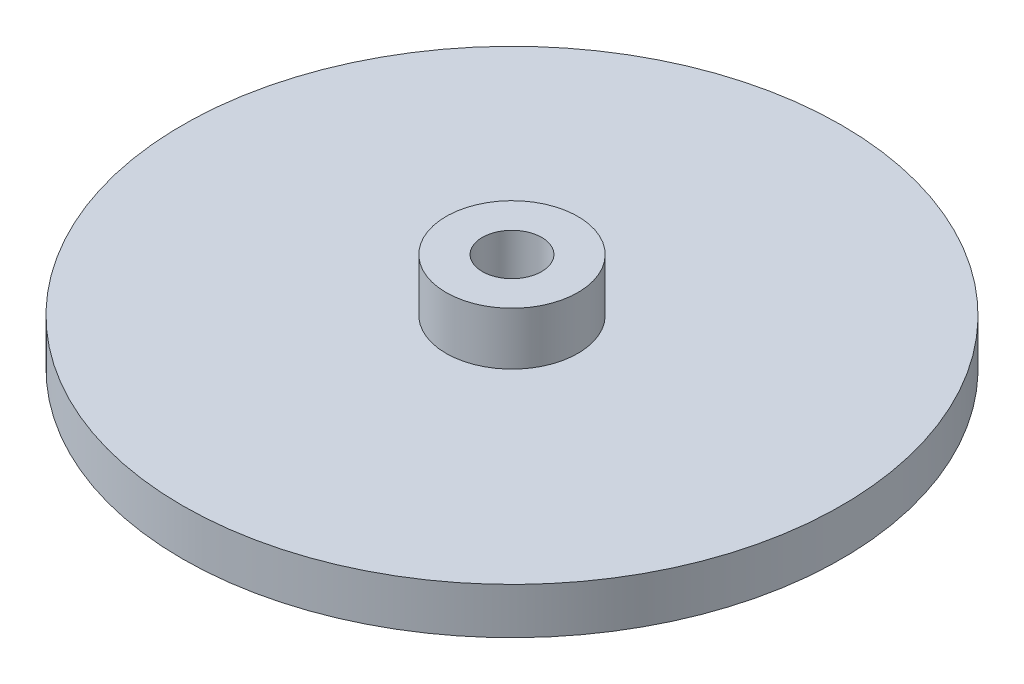
from build123d import *

# Parameters (mm, degrees)
SKETCH1_R           = 25
BOSS_EXTRUDE1_DEPTH = 2
SKETCH2_R           = 5
BOSS_EXTRUDE2_DEPTH = 4
SKETCH3_R           = 2.1
CUT_EXTRUDE1_DEPTH  = 20
SKETCH4_R           = 4.5
CUT_EXTRUDE2_DEPTH  = 5
SKETCH5_R           = 2.25
CUT_EXTRUDE3_DEPTH  = 10
BOSS_EXTRUDE3_START = 1.5
SKETCH6_R           = 25
SKETCH6_R_2         = 4.5
BOSS_EXTRUDE3_DEPTH = 1.5
BOSS_EXTRUDE5_START = 3.5
SKETCH7_R           = 4.5
SKETCH7_R_2         = 2.25
BOSS_EXTRUDE5_DEPTH = 3.5


with BuildPart() as part:
    # Sketch1 → Boss-Extrude1 (new body)
    with BuildSketch(Plane(origin=(0, 0, 0), x_dir=(1, 0, 0), z_dir=(0, 1, 0))):
        with Locations(Location((0, 0, 0), (0, 0, 270))):
            Circle(SKETCH1_R)
    extrude(amount=BOSS_EXTRUDE1_DEPTH)

    # Sketch2 → Boss-Extrude2 (add)
    with BuildSketch(Plane(origin=(0, 2, 0), x_dir=(1, 0, 0), z_dir=(0, 1, 0))):
        with Locations(Location((0, 0, 0), (0, 0, 270))):
            Circle(SKETCH2_R)
    extrude(amount=BOSS_EXTRUDE2_DEPTH)

    # Sketch3 → Cut-Extrude1 (cut)
    with BuildSketch(Plane.XZ):
        with Locations(Location((0, 0, 0), (0, 0, 270))):
            Circle(SKETCH3_R)
    extrude(amount=-CUT_EXTRUDE1_DEPTH, mode=Mode.SUBTRACT)

    # Sketch4 → Cut-Extrude2 (cut)
    with BuildSketch(Plane.XZ):
        with Locations(Location((0, 0, 0), (0, 0, 270))):
            Circle(SKETCH4_R)
    extrude(amount=-CUT_EXTRUDE2_DEPTH, mode=Mode.SUBTRACT)

    # Sketch5 → Cut-Extrude3 (cut)
    with BuildSketch(Plane.XZ.offset(-5)):
        with Locations(Location((0, 0, 0), (0, 0, 270))):
            Circle(SKETCH5_R)
    extrude(amount=-CUT_EXTRUDE3_DEPTH, mode=Mode.SUBTRACT)

    # Sketch6 → Boss-Extrude3 (add)
    with BuildSketch(Plane.XZ.offset(BOSS_EXTRUDE3_START)):
        with Locations(Location((0, 0, 0), (0, 0, 270))):
            Circle(SKETCH6_R)
        with Locations(Location((0, 0, 0), (0, 0, 270))):
            Circle(SKETCH6_R_2, mode=Mode.SUBTRACT)
    extrude(amount=-BOSS_EXTRUDE3_DEPTH)

    # Sketch7 → Boss-Extrude5 (add)
    with BuildSketch(Plane.XZ.offset(-5).offset(BOSS_EXTRUDE5_START)):
        with Locations(Location((0, 0, 0), (0, 0, 270))):
            Circle(SKETCH7_R)
        with Locations(Location((0, 0, 0), (0, 0, 270))):
            Circle(SKETCH7_R_2, mode=Mode.SUBTRACT)
    extrude(amount=-BOSS_EXTRUDE5_DEPTH)


solid = part.part
